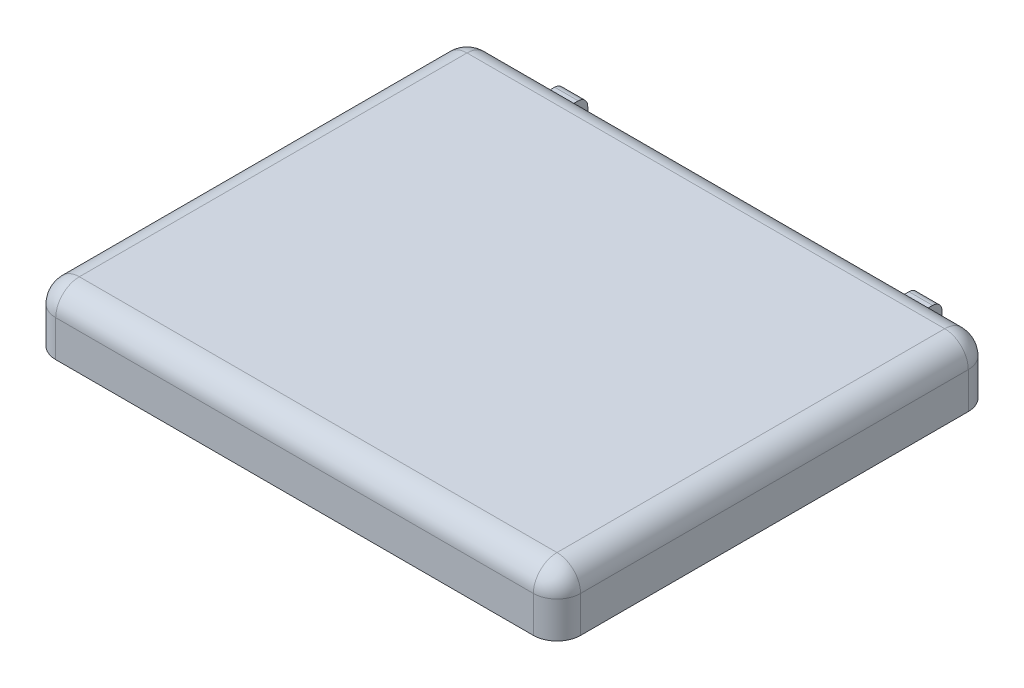
from build123d import *

# Parameters (mm, degrees)
FILLET1_R            = 10
SHELL1_T             = -3.175
SKETCH7_W            = 10
SKETCH7_H            = 39
SKETCH7_R            = 1
BOSS_EXTRUDE1_DEPTH  = 10
FILLET2_R            = 4
FILLET2_OF_MIRROR1_R = 4


with BuildPart() as part:
    # Sketch1 → Loft3 section 0
    with BuildSketch(Plane(origin=(0, 0, 0), x_dir=(1, 0, 0), z_dir=(0, 1, 0))):
        with BuildLine():
            Line((111.125, -92.075), (-111.125, -92.075))
            Line((-111.125, -92.075), (-111.125, 92.075))
            Line((-111.125, 92.075), (111.125, 92.075))
            Line((111.125, 92.075), (111.125, -92.075))
        make_face()
    # Sketch2 → Loft3 section 1
    with BuildSketch(Plane(origin=(0, 25.4, 0), x_dir=(1, 0, 0), z_dir=(0, 1, 0))):
        with BuildLine():
            Line((111.125, 92.075), (-111.125, 92.075))
            Line((-111.125, 92.075), (-111.125, -92.075))
            Line((-111.125, -92.075), (111.125, -92.075))
            Line((111.125, -92.075), (111.125, 92.075))
        make_face()
    loft()

    # Fillet1
    fillet1_edges = [part.edges().sort_by_distance(p)[0] for p in [
        (0, 25.4, -92.075),
        (111.125, 25.4, 0),
        (0, 25.4, 92.075),
        (-111.125, 25.4, 0),
        (111.125, 12.7, -92.075),
        (111.125, 12.7, 92.075),
        (-111.125, 12.7, -92.075),
        (-111.125, 12.7, 92.075),
    ]]
    fillet(fillet1_edges, radius=FILLET1_R)

    # Shell1
    shell1_openings = [part.faces().sort_by_distance(p)[0] for p in [
        (-6.8e-08, 0, 8.2e-08),
    ]]
    offset(amount=SHELL1_T, openings=shell1_openings)

    # Sketch7 → Boss-Extrude1 (add)
    with BuildSketch(Plane(origin=(70, 0, 0), x_dir=(0, 0, -1), z_dir=(1, 0, 0))):
        with Locations((97.075, -4.1)):
            Rectangle(SKETCH7_W, SKETCH7_H)
        with Locations((95.075, -18.2245)):
            Circle(SKETCH7_R, mode=Mode.SUBTRACT)
    boss_extrude1 = extrude(amount=BOSS_EXTRUDE1_DEPTH)

    # Fillet2
    fillet2_edges = [part.edges().sort_by_distance(p)[0] for p in [
        (75, -23.6, -102.075),
        (75, 15.4, -102.075),
        (70, -23.6, -97.075),
        (75, -23.6, -92.075),
        (80, -23.6, -97.075),
    ]]
    fillet(fillet2_edges, radius=FILLET2_R)

    # Mirror1: Boss-Extrude1 across plane
    add(boss_extrude1.mirror(Plane(origin=(0, 0, 0), x_dir=(0, 0, 1), z_dir=(1, 0, 0))))

    # Fillet2 of Mirror1
    fillet2_of_mirror1_edges = [part.edges().sort_by_distance(p)[0] for p in [
        (-75, -23.6, -102.075),
        (-75, 15.4, -102.075),
        (-70, -23.6, -97.075),
        (-75, -23.6, -92.075),
        (-80, -23.6, -97.075),
    ]]
    fillet(fillet2_of_mirror1_edges, radius=FILLET2_OF_MIRROR1_R)


solid = part.part
